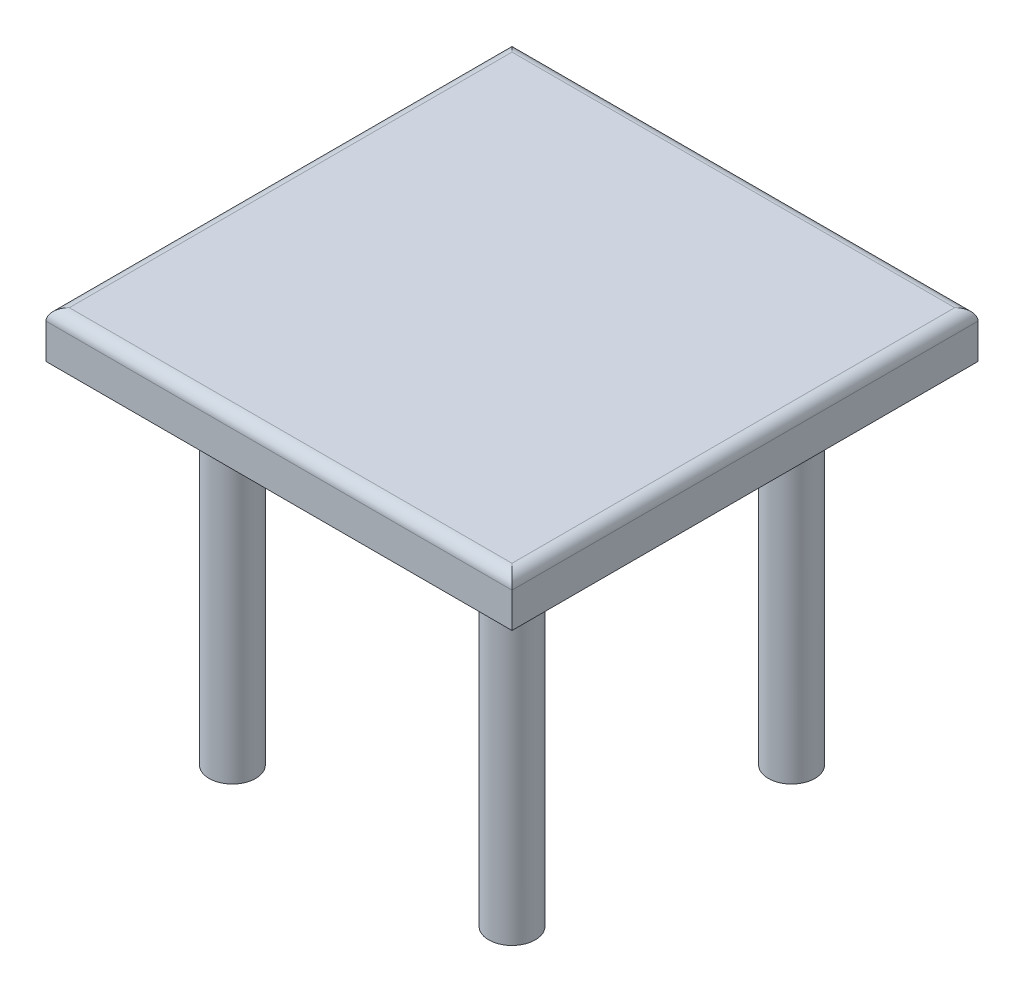
from build123d import *

# Parameters (mm, degrees)
SKETCH_1_W      = 200
SKETCH_1_H      = 200
EXTRUDE_1_DEPTH = 20
FILLET_1_R      = 5
SKETCH_4_R      = 10
EXTRUDE_4_DEPTH = 150


with BuildPart() as part:
    # 草图1 → 凸台-拉伸1 (new body)
    with BuildSketch(Plane(origin=(0, 0, 0), x_dir=(1, 0, 0), z_dir=(0, 1, 0))):
        Rectangle(SKETCH_1_W, SKETCH_1_H)
    extrude(amount=-EXTRUDE_1_DEPTH)

    # 圆角1
    fillet_1_edges = [part.edges().sort_by_distance(p)[0] for p in [
        (0, 0, -100),
        (100, 0, 0),
        (0, 0, 100),
        (-100, 0, 0),
    ]]
    fillet(fillet_1_edges, radius=FILLET_1_R)

    # 草图4 → 凸台-拉伸4 (add)
    with BuildSketch(Plane(origin=(0, -20, 0), x_dir=(1, 0, 0), z_dir=(0, 1, 0))):
        with Locations(Location((-60, 60, 0), (0, 0, 270))):
            Circle(SKETCH_4_R)
        with Locations(Location((60, 60, 0), (0, 0, 270))):
            Circle(SKETCH_4_R)
        with Locations(Location((-60, -60, 0), (0, 0, 270))):
            Circle(SKETCH_4_R)
        with Locations(Location((60, -60, 0), (0, 0, 270))):
            Circle(SKETCH_4_R)
    extrude(amount=-EXTRUDE_4_DEPTH)


solid = part.part
